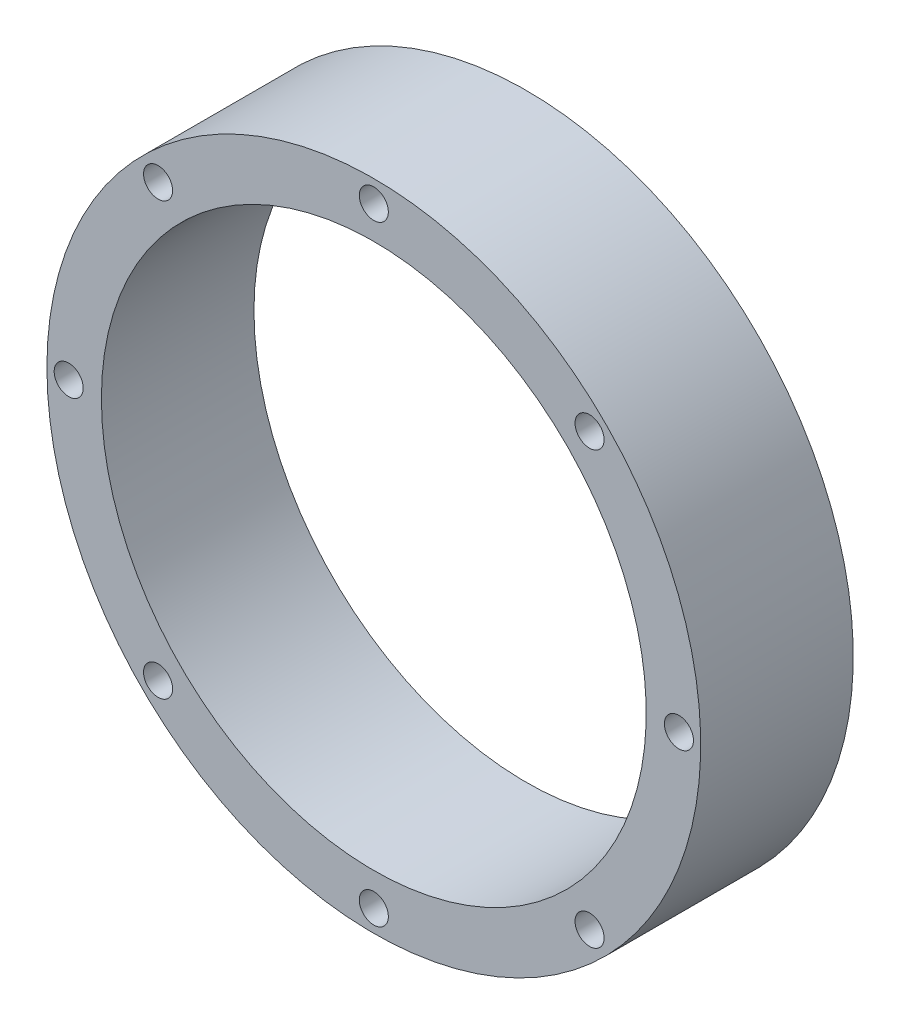
from build123d import *

# Parameters (mm, degrees)
SKETCH1_R                       = 45
SKETCH1_R_2                     = 37.5
BOSS_EXTRUDE1_DEPTH             = 21
F_4_0MM_DOWEL_HOLE1_D           = 4
F_4_0MM_DOWEL_HOLE1_CSINK_D     = 4.05
F_4_0MM_DOWEL_HOLE1_CSINK_ANGLE = 90


with BuildPart() as part:
    # Sketch1 → Boss-Extrude1 (new body)
    with BuildSketch(Plane.XY):
        with Locations(Location((0, 0, 0), (0, 0, 180))):
            Circle(SKETCH1_R)
        with Locations(Location((0, 0, 0), (0, 0, 180))):
            Circle(SKETCH1_R_2, mode=Mode.SUBTRACT)
    extrude(amount=BOSS_EXTRUDE1_DEPTH)

    # Ø4.0mm Dowel Hole1 (through all)
    with Locations(Plane(origin=(0, 0, 0), x_dir=(-1, 0, 0), z_dir=(0, 0, -1))):
        with Locations((29.69848481, 29.69848481), (0, 42), (-29.69848481, 29.69848481), (-42, 0), (-29.69848481, -29.69848481), (0, -42), (29.69848481, -29.69848481), (42, 0)):
            CounterSinkHole(F_4_0MM_DOWEL_HOLE1_D / 2, F_4_0MM_DOWEL_HOLE1_CSINK_D / 2, counter_sink_angle=F_4_0MM_DOWEL_HOLE1_CSINK_ANGLE)


solid = part.part
